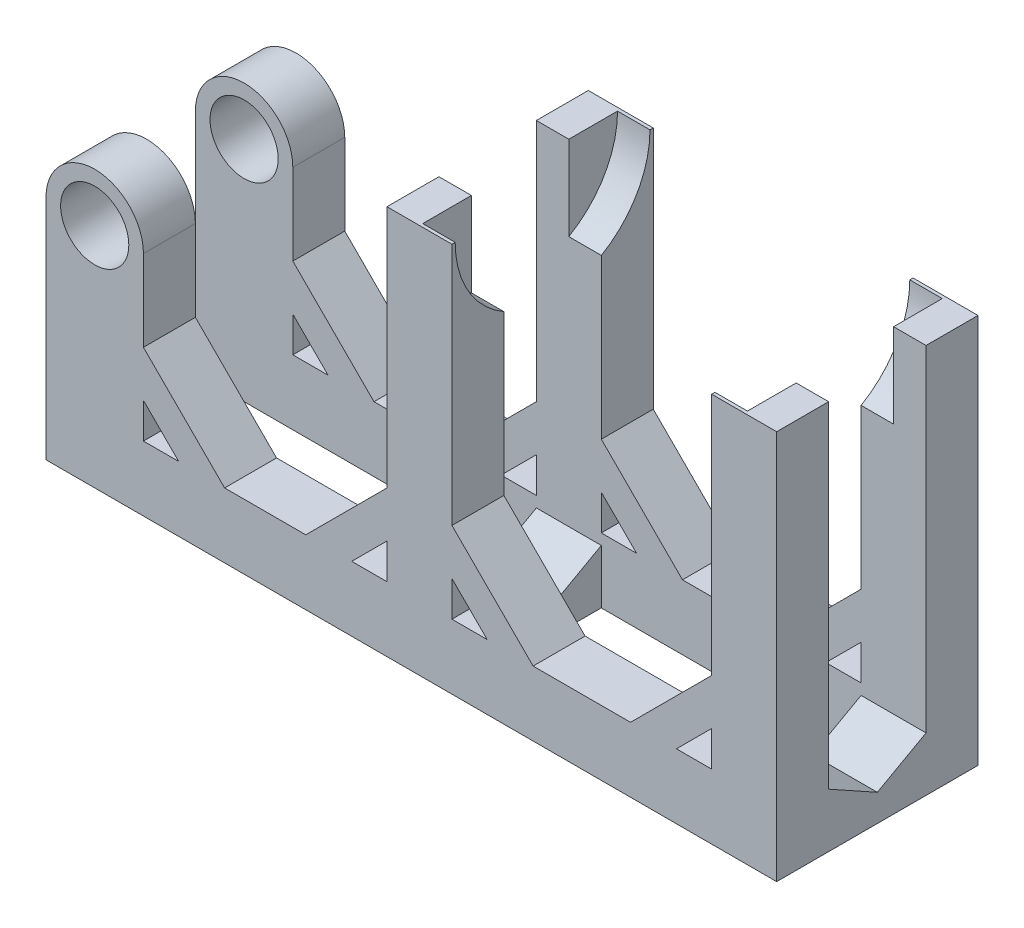
from build123d import *

# Parameters (mm, degrees)
SKETCH1_R            = 5.25
BOSS_EXTRUDE1_DEPTH  = 8
BOSS_EXTRUDE2_DEPTH  = 10
LPATTERN1_COUNT      = 2
LPATTERN1_PITCH      = 50
MIRROR1_COPY_1_DEPTH = 10
CUT_EXTRUDE1_START   = -5
SKETCH3_R            = 15
CUT_EXTRUDE1_DEPTH   = 50


with BuildPart() as part:
    # Sketch1 → Boss-Extrude1 (new body)
    with BuildSketch(Plane.XY):
        with BuildLine():
            Line((105, 0), (105, 60))
            Line((105, 60), (95, 60))
            Line((95, 60), (95, 22.5))
            Line((95, 22.5), (82.5, 10))
            Line((82.5, 10), (67.5, 10))
            Line((67.5, 10), (55, 22.5))
            Line((55, 22.5), (55, 60))
            Line((55, 60), (45, 60))
            Line((45, 60), (45, 22.5))
            Line((45, 22.5), (32.5, 10))
            Line((32.5, 10), (20, 10))
            Line((20, 10), (7.5, 22.5))
            Line((7.5, 22.5), (7.5, 35))
            ThreePointArc((7.5, 35), (0, 42.5), (-7.5, 35))
            Line((-7.5, 35), (-7.5, 0))
            Line((-7.5, 0), (105, 0))
        make_face()
        Polygon((45, 15.428932188), (45, 10), (39.571067812, 10), align=None, mode=Mode.SUBTRACT)
        Polygon((60.428932188, 10), (55, 10), (55, 15.428932188), align=None, mode=Mode.SUBTRACT)
        Polygon((95, 15.428932188), (95, 10), (89.571067812, 10), align=None, mode=Mode.SUBTRACT)
        with Locations((0, 35)):
            Circle(SKETCH1_R, mode=Mode.SUBTRACT)
        Polygon((7.5, 15.428932188), (12.928932188, 10), (7.5, 10), align=None, mode=Mode.SUBTRACT)
    boss_extrude1 = extrude(amount=BOSS_EXTRUDE1_DEPTH)

    # Sketch2 → Boss-Extrude2 (add)
    with BuildSketch(Plane(origin=(45, 0, 0), x_dir=(0, 0, -1), z_dir=(1, 0, 0))):
        Polygon((7.5, 4.166666667), (0, 8.333333333), (0, 0), (7.5, 0), align=None)
    boss_extrude2 = extrude(amount=BOSS_EXTRUDE2_DEPTH)

    # LPattern1: Boss-Extrude2 ×2
    with Locations(*[(i * LPATTERN1_PITCH, 0, 0) for i in range(1, LPATTERN1_COUNT)]):
        add(boss_extrude2)

    # Mirror1: Boss-Extrude1, Boss-Extrude2 across plane
    add(boss_extrude1.mirror(Plane(origin=(55, 0, -7.5), x_dir=(1, 0, 0), z_dir=(0, 0, 1))))
    add(boss_extrude2.mirror(Plane(origin=(55, 0, -7.5), x_dir=(1, 0, 0), z_dir=(0, 0, 1))))

    # Mirror1 copy 1 sketch → Mirror1 copy 1 (add)
    with BuildSketch(Plane(origin=(95, 0, -15), x_dir=(0, 0, 1), z_dir=(1, 0, 0))):
        Polygon((7.5, -4.166666667), (0, -8.333333333), (0, 0), (7.5, 0), align=None)
    extrude(amount=MIRROR1_COPY_1_DEPTH)

    # Sketch3 → Cut-Extrude1 (cut)
    with BuildSketch(Plane(origin=(55, 0, 0), x_dir=(0, 0, -1), z_dir=(1, 0, 0)).offset(CUT_EXTRUDE1_START)):
        with Locations((7.5, 60)):
            Circle(SKETCH3_R)
    extrude(amount=CUT_EXTRUDE1_DEPTH, mode=Mode.SUBTRACT)


solid = part.part
